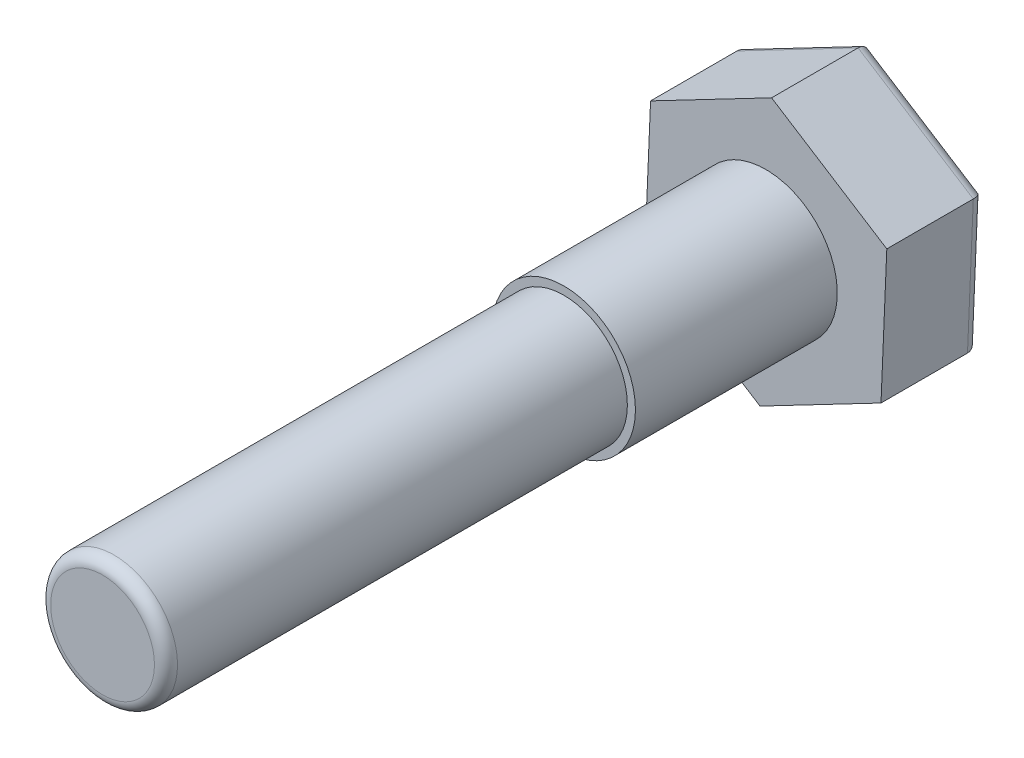
from build123d import *

# Parameters (mm, degrees)
EXTRUDE_305_DEPTH = 17
SKETCH_2_R        = 12.4
EXTRUDE_1_DEPTH   = 35
FILLET_3_R        = 2
SKETCH_3_R        = 11
EXTRUDE_2_DEPTH   = 80
FILLET_4_R        = 2


with BuildPart() as part:
    # 草图1 → Extrude 305 (new body)
    with BuildSketch(Plane.XY):
        Polygon((20.984201837, 10.954296262), (1.005402075, 23.65), (-19.978799762, 12.695703738), (-20.984201837, -10.954296262), (-1.005402075, -23.65), (19.978799762, -12.695703738), align=None)
    extrude(amount=EXTRUDE_305_DEPTH)

    # 草图2 → 凸台-拉伸1 (add)
    with BuildSketch(Plane.XY.offset(17)):
        with Locations(Location((0, 0, 0), (0, 0, 180))):
            Circle(SKETCH_2_R)
    extrude(amount=EXTRUDE_1_DEPTH)

    # 圆角3
    fillet_3_edges = [part.edges().sort_by_distance(p)[0] for p in [
        (9.486698843, -18.172851869, 0),
        (-10.994801956, -17.302148131, 0),
        (-20.4815008, 0.870703738, 0),
        (-9.486698843, 18.172851869, 0),
        (10.994801956, 17.302148131, 0),
        (20.4815008, -0.870703738, 0),
    ]]
    fillet(fillet_3_edges, radius=FILLET_3_R)

    # 草图3 → 凸台-拉伸2 (add)
    with BuildSketch(Plane.XY.offset(52)):
        Circle(SKETCH_3_R)
    extrude(amount=EXTRUDE_2_DEPTH)

    # 圆角4
    fillet_4_edges = [part.edges().sort_by_distance(p)[0] for p in [
        (-11, 0, 132),
    ]]
    fillet(fillet_4_edges, radius=FILLET_4_R)


solid = part.part
